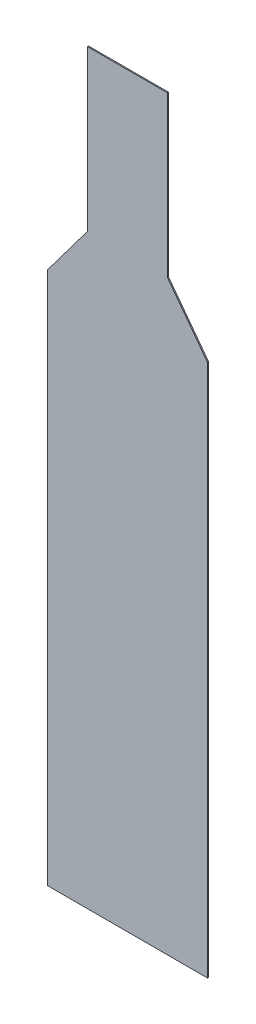
from build123d import *

# Parameters (mm, degrees)
BOSS_EXTRUDE1_DEPTH = 0.1


with BuildPart() as part:
    # Sketch1 → Boss-Extrude1 (new body)
    with BuildSketch(Plane.XY):
        Polygon((7.5, 0), (-7.5, 0), (-7.5, 50), (-3.75, 55), (-3.75, 70), (3.75, 70), (3.75, 55), (7.5, 50), align=None)
    extrude(amount=BOSS_EXTRUDE1_DEPTH)


solid = part.part
